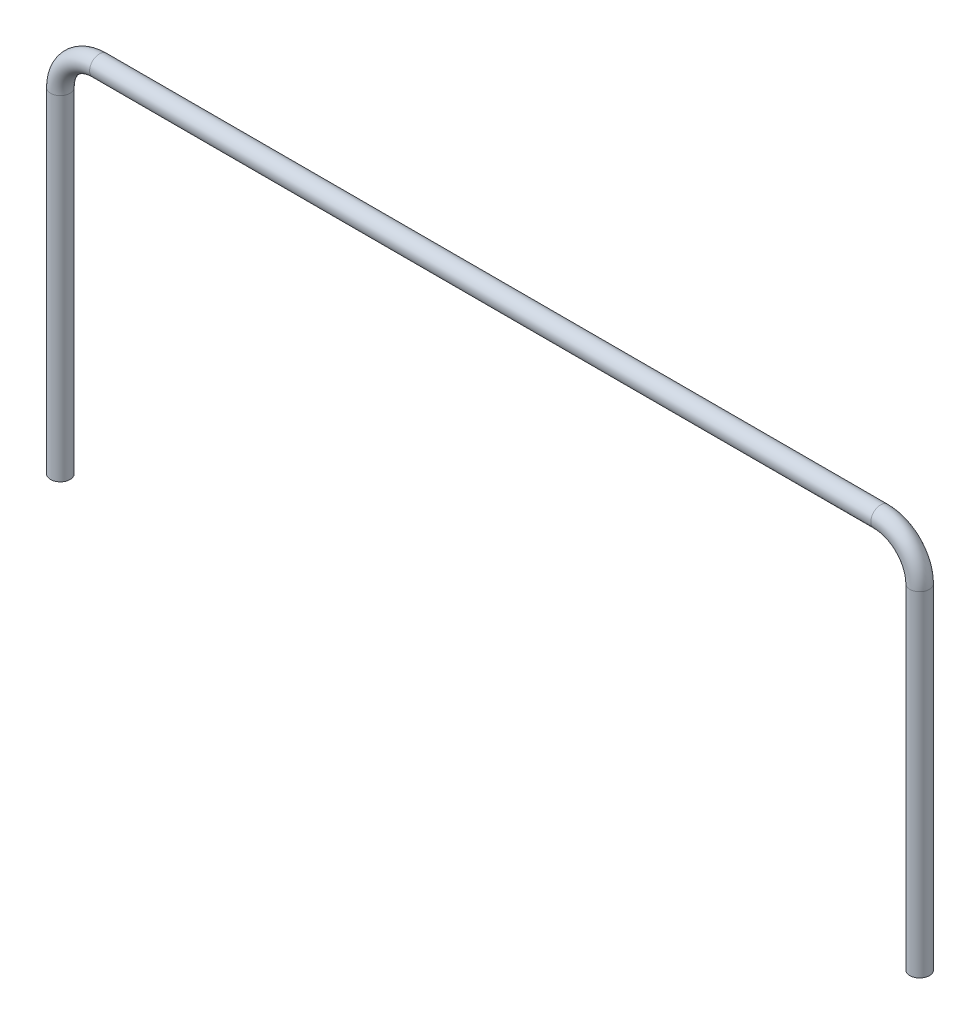
from build123d import *

# Parameters (mm, degrees)
ESQUISSE2_R = 0.5


with BuildPart() as part:
    # Balayage1: sweep along a path in Esquisse1
    with BuildLine(Plane.XY) as balayage1_path:
        Line((-8.67886357, 0), (-8.67886357, 17.12919258))
        ThreePointArc((-8.67886357, 17.12919258), (-8.093077132, 18.543406142), (-6.67886357, 19.12919258))
        Line((-6.67886357, 19.12919258), (33.32113643, 19.12919258))
        ThreePointArc((33.32113643, 19.12919258), (34.735349992, 18.543406142), (35.32113643, 17.12919258))
        Line((35.32113643, 17.12919258), (35.32113643, 0))
    # Esquisse2 → Balayage1 (sweep)
    with BuildSketch(Plane(origin=(0, 0, 0), x_dir=(1, 0, 0), z_dir=(0, 1, 0))):
        with Locations((-8.67886357, 0)):
            Circle(ESQUISSE2_R)
    sweep(path=balayage1_path.line)


solid = part.part
